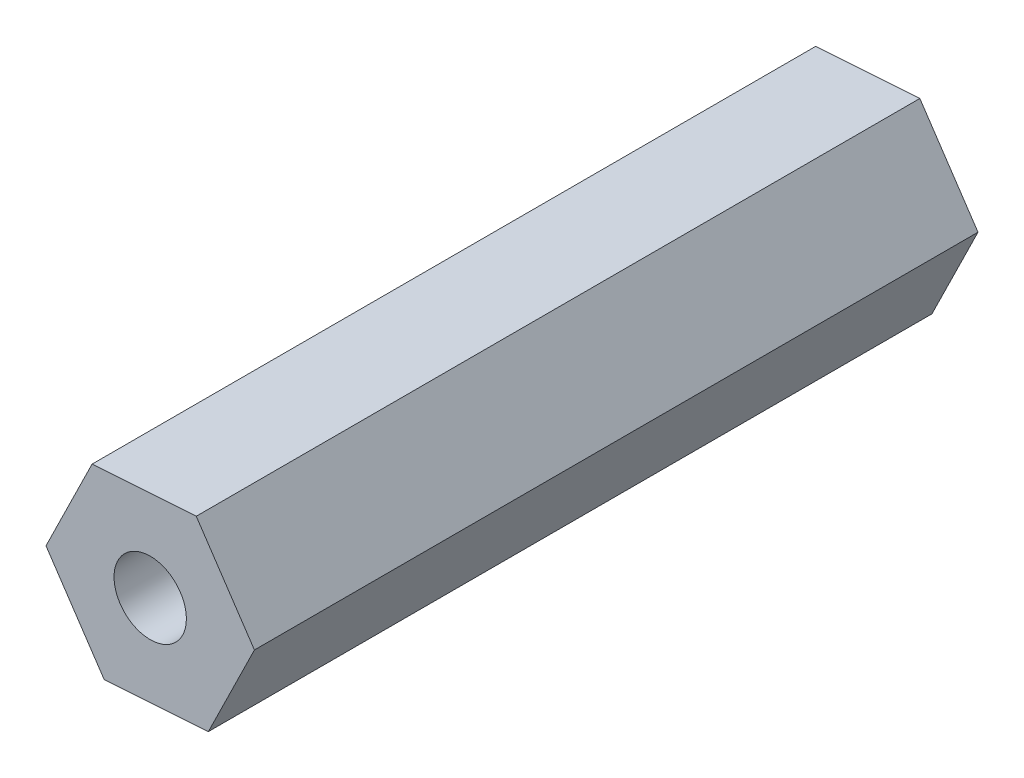
from build123d import *

# Parameters (mm, degrees)
SKETCH1_R           = 2.54
BOSS_EXTRUDE1_DEPTH = 50.8


with BuildPart() as part:
    # Sketch1 → Boss-Extrude1 (new body)
    with BuildSketch(Plane.XY):
        Polygon((4.083085833, -6.090299124), (7.315896674, 0.490906495), (3.232810841, 6.581205619), (-4.083085833, 6.090299124), (-7.315896674, -0.490906495), (-3.232810841, -6.581205619), align=None)
        Circle(SKETCH1_R, mode=Mode.SUBTRACT)
    extrude(amount=BOSS_EXTRUDE1_DEPTH)


solid = part.part
